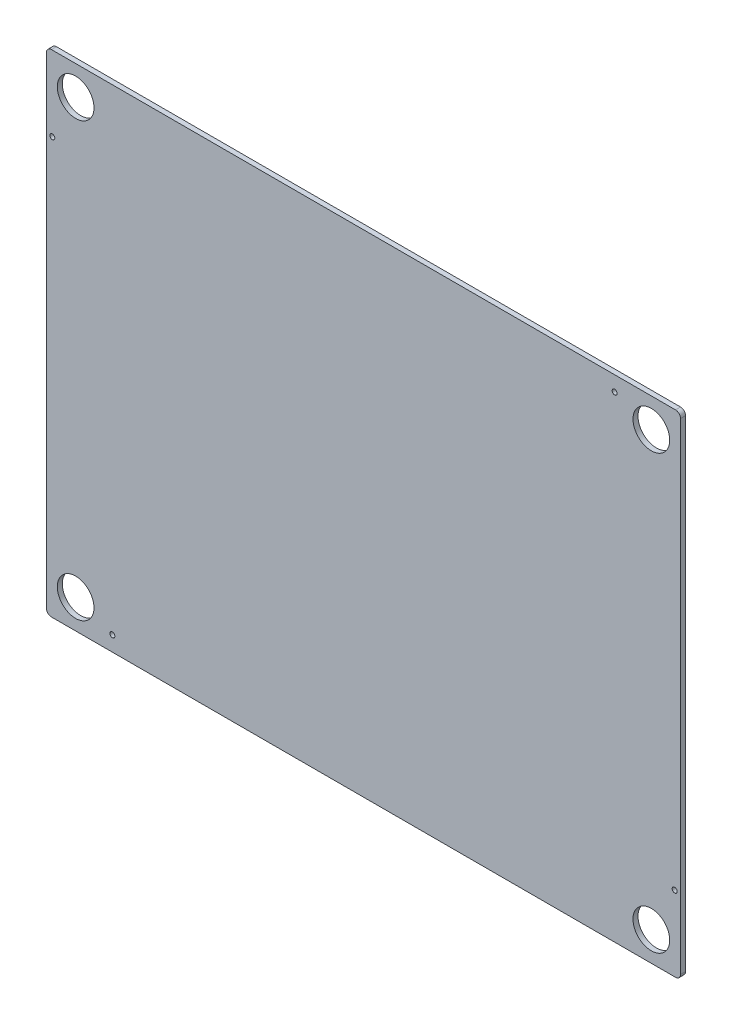
from build123d import *

# Parameters (mm, degrees)
SKETCH1_W           = 380
SKETCH1_H           = 294.5
SKETCH1_R           = 11
SKETCH1_R_2         = 1.5
BOSS_EXTRUDE1_DEPTH = 3
FILLET1_R           = 3


with BuildPart() as part:
    # Sketch1 → Boss-Extrude1 (new body)
    with BuildSketch(Plane.XY):
        Rectangle(SKETCH1_W, SKETCH1_H)
        with Locations((-172.5, 129.75)):
            Circle(SKETCH1_R, mode=Mode.SUBTRACT)
        with Locations(Location((172.5, 129.75, 0), (0, 0, 180))):
            Circle(SKETCH1_R, mode=Mode.SUBTRACT)
        with Locations((172.5, -129.75)):
            Circle(SKETCH1_R, mode=Mode.SUBTRACT)
        with Locations(Location((-172.5, -129.75, 0), (0, 0, 180))):
            Circle(SKETCH1_R, mode=Mode.SUBTRACT)
        with Locations((150.5, 138.25)):
            Circle(SKETCH1_R_2, mode=Mode.SUBTRACT)
        with Locations((-186.5, 102.25)):
            Circle(SKETCH1_R_2, mode=Mode.SUBTRACT)
        with Locations((-150.5, -138.25)):
            Circle(SKETCH1_R_2, mode=Mode.SUBTRACT)
        with Locations((186.5, -102.25)):
            Circle(SKETCH1_R_2, mode=Mode.SUBTRACT)
    extrude(amount=BOSS_EXTRUDE1_DEPTH)

    # Fillet1
    fillet1_edges = [part.edges().sort_by_distance(p)[0] for p in [
        (-190, 147.25, 1.5),
        (190, 147.25, 1.5),
        (190, -147.25, 1.5),
        (-190, -147.25, 1.5),
    ]]
    fillet(fillet1_edges, radius=FILLET1_R)


solid = part.part
